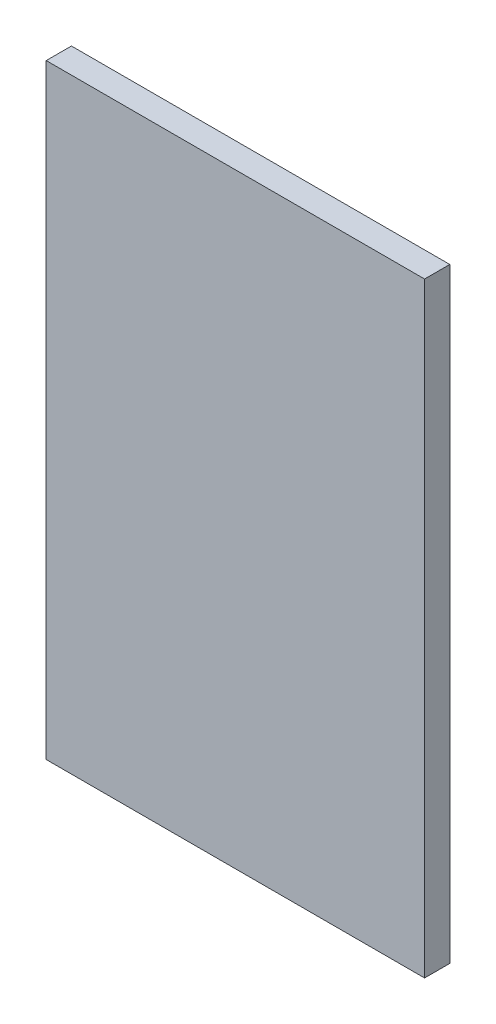
from build123d import *

# Parameters (mm, degrees)
SKETCH1_W           = 75
SKETCH1_H           = 120
BOSS_EXTRUDE1_DEPTH = 5


with BuildPart() as part:
    # Sketch1 → Boss-Extrude1 (new body)
    with BuildSketch(Plane.XY):
        with Locations((0, -60)):
            Rectangle(SKETCH1_W, SKETCH1_H)
    extrude(amount=BOSS_EXTRUDE1_DEPTH)


solid = part.part
